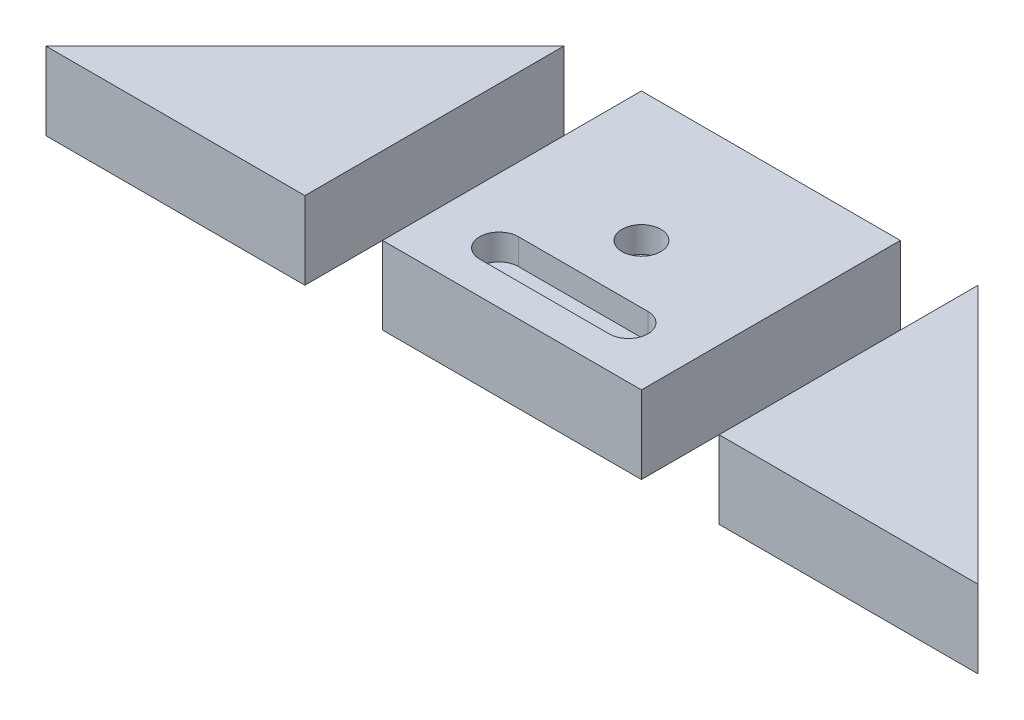
from build123d import *

# Parameters (mm, degrees)
EXTRUDE_1_DEPTH     = 30
SKETCH_2_W          = 100
SKETCH_2_H          = 100
EXTRUDE_1_2_DEPTH   = 30
SKETCH_10_R         = 7.5
CUT_EXTRUDE_1_DEPTH = 10


with BuildPart() as part:
    # 草图2 → 凸台-拉伸1 (new body)
    with BuildSketch(Plane(origin=(0, 0, 0), x_dir=(1, 0, 0), z_dir=(0, 1, 0))):
        Polygon((80, -50), (180, -50), (80, 50), align=None)
    extrude(amount=EXTRUDE_1_DEPTH)


with BuildPart() as body_2:
    # 草图2 → Extrude 1 2 (new body)
    with BuildSketch(Plane(origin=(0, 0, 0), x_dir=(1, 0, 0), z_dir=(0, 1, 0))):
        Rectangle(SKETCH_2_W, SKETCH_2_H)
    extrude(amount=EXTRUDE_1_2_DEPTH)

    # 草图10 → 切除-拉伸1 (cut)
    with BuildSketch(Plane(origin=(0, 30, 0), x_dir=(1, 0, 0), z_dir=(0, 1, 0))):
        Circle(SKETCH_10_R)
        with BuildLine():
            Line((-25, -22.5), (25, -22.5))
            ThreePointArc((25, -22.5), (32.5, -30), (25, -37.5))
            Line((25, -37.5), (-25, -37.5))
            ThreePointArc((-25, -37.5), (-32.5, -30), (-25, -22.5))
        make_face()
    extrude(amount=-CUT_EXTRUDE_1_DEPTH, mode=Mode.SUBTRACT)


with BuildPart() as body_3:
    # 镜向4: mirrored copy
    add(part.part.mirror(Plane(origin=(0, 0, 0), x_dir=(0, 0, 1), z_dir=(1, 0, 0))))


solid = Compound([part.part, body_2.part, body_3.part])
